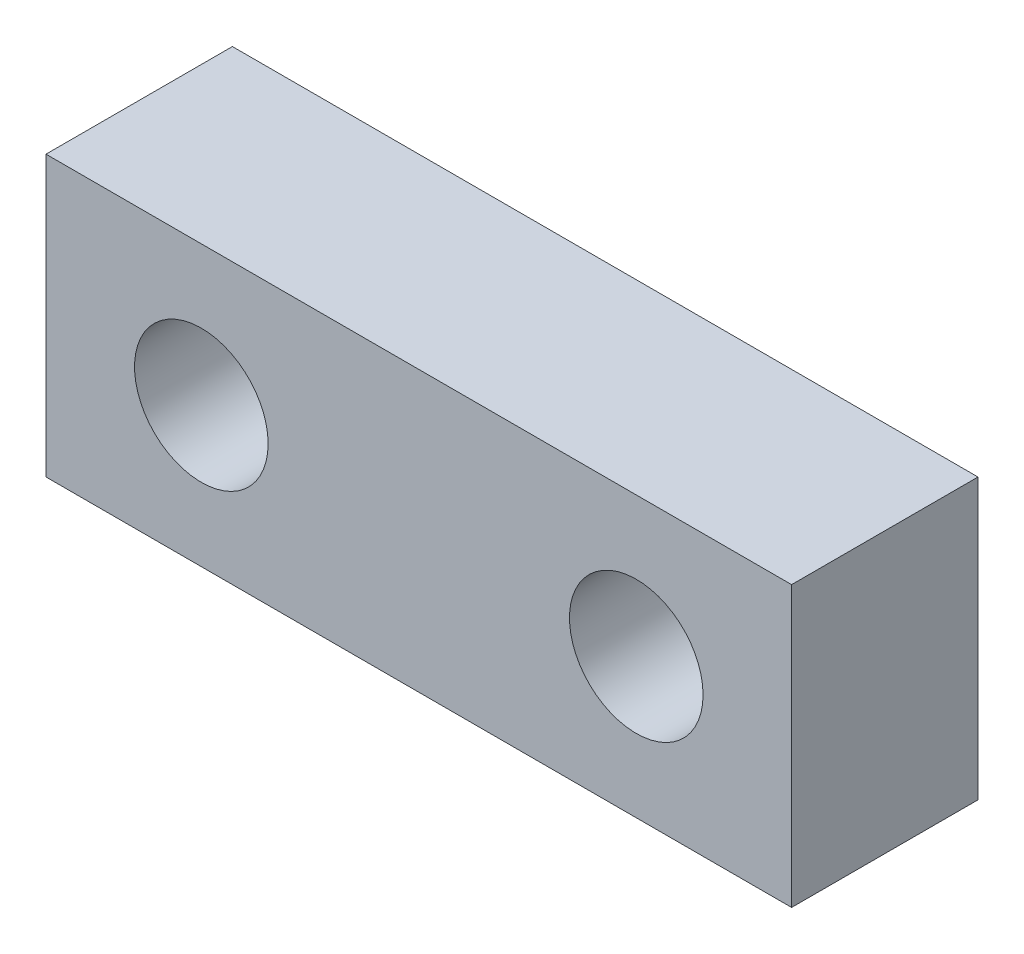
from build123d import *

# Parameters (mm, degrees)
SKETCH_1_W             = 120
SKETCH_1_H             = 45
EXTRUDE_1_DEPTH        = 30
CUT_EXTRUDE_1_REACH    = 72.755
SKETCH_2_R             = 10.75
HOLE_WIZARD_M3_1_D     = 2.5
HOLE_WIZARD_M3_1_DEPTH = 7.5
HOLE_WIZARD_M3_1_TIP   = 0.751075774
HOLE_WIZARD_M4_1_D     = 3.3
HOLE_WIZARD_M4_1_DEPTH = 10.1
HOLE_WIZARD_M4_1_TIP   = 0.991420021


with BuildPart() as part:
    # 草图1 → 凸台-拉伸1 (new body)
    with BuildSketch(Plane.XY):
        Rectangle(SKETCH_1_W, SKETCH_1_H)
    extrude(amount=EXTRUDE_1_DEPTH)

    # 草图2 → 切除-拉伸1 (cut, up to next)
    with BuildSketch(Plane.XY.offset(30), mode=Mode.PRIVATE) as cut_extrude_1_sk1:
        with Locations((-35, 0)):
            Circle(SKETCH_2_R)
    cut_extrude_1_tool1 = extrude(cut_extrude_1_sk1.sketch, amount=-CUT_EXTRUDE_1_REACH, mode=Mode.PRIVATE) & part.part
    # 草图2 → 切除-拉伸1 (cut, up to next)
    with BuildSketch(Plane.XY.offset(30), mode=Mode.PRIVATE) as cut_extrude_1_sk2:
        with Locations((35, 0)):
            Circle(SKETCH_2_R)
    cut_extrude_1_tool2 = extrude(cut_extrude_1_sk2.sketch, amount=-CUT_EXTRUDE_1_REACH, mode=Mode.PRIVATE) & part.part
    add(cut_extrude_1_tool1.solids().sort_by_distance((-35, 0, 30))[0], mode=Mode.SUBTRACT)
    add(cut_extrude_1_tool2.solids().sort_by_distance((35, 0, 30))[0], mode=Mode.SUBTRACT)

    # M3 螺纹孔1
    with Locations(Plane(origin=(0, -22.5, 0), x_dir=(-1, 0, 0), z_dir=(0, -1, 0))):
        with Locations((-40.606601718, -4.393398282), (-19.393398282, -4.393398282), (-19.393398282, -25.606601718), (-40.606601718, -25.606601718), (19.393398282, -4.393398282), (40.606601718, -4.393398282), (19.393398282, -25.606601718), (40.606601718, -25.606601718)):
            Hole(HOLE_WIZARD_M3_1_D / 2, depth=HOLE_WIZARD_M3_1_DEPTH)
            with Locations((0, 0, -(HOLE_WIZARD_M3_1_DEPTH + HOLE_WIZARD_M3_1_TIP / 2))):  # 118° drill point
                Cone(0, HOLE_WIZARD_M3_1_D / 2, HOLE_WIZARD_M3_1_TIP, mode=Mode.SUBTRACT)

    # M4 螺纹孔1
    with Locations(Plane(origin=(-46.3, 11.3, 0), x_dir=(-1, 0, 0), z_dir=(0, 0, -1))):
        with Locations((0, 0), (0, -22.6), (-22.6, -22.6), (-22.6, 0), (-70, 0), (-70, -22.6), (-92.6, -22.6), (-92.6, 0)):
            Hole(HOLE_WIZARD_M4_1_D / 2, depth=HOLE_WIZARD_M4_1_DEPTH)
            with Locations((0, 0, -(HOLE_WIZARD_M4_1_DEPTH + HOLE_WIZARD_M4_1_TIP / 2))):  # 118° drill point
                Cone(0, HOLE_WIZARD_M4_1_D / 2, HOLE_WIZARD_M4_1_TIP, mode=Mode.SUBTRACT)


solid = part.part
